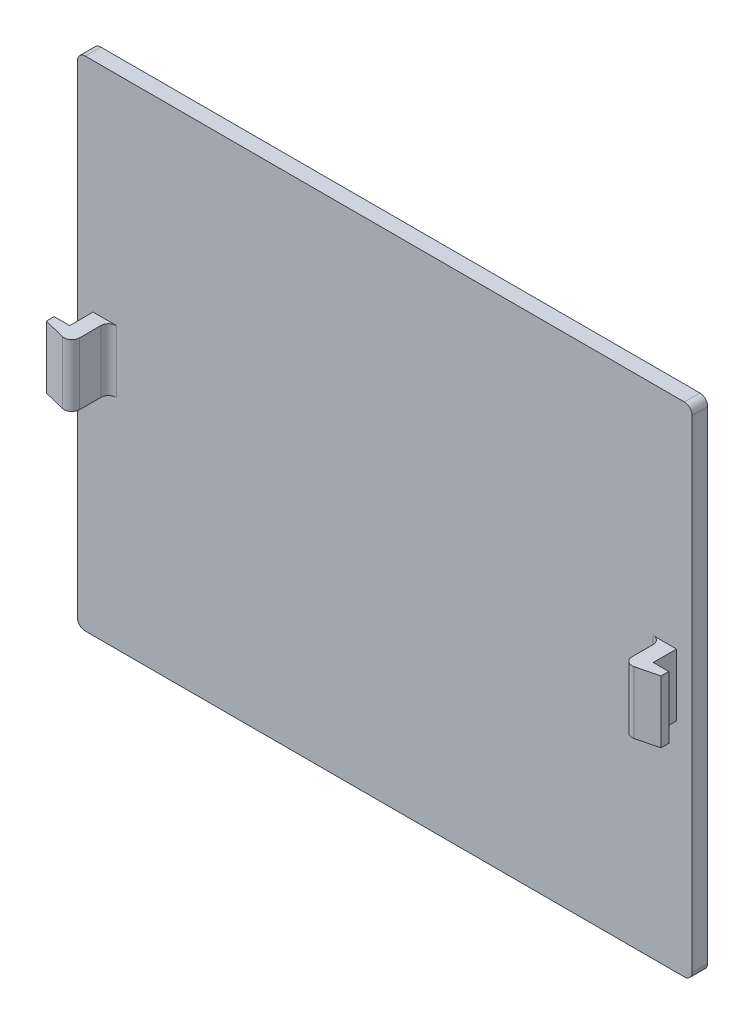
from build123d import *

# Parameters (mm, degrees)
SKETCH_211_W             = 2
SKETCH_211_H             = 8
EXTRUDE_1442_DEPTH       = 2
EXTRUDE_START            = 2
SKETCH_3_W               = 2
SKETCH_3_H               = 8
EXTRUDE_1490_DEPTH       = 3
EXTRUDE_START_2          = 5
SKETCH_4_W               = 2
SKETCH_4_H               = 8
EXTRUDE_1_DEPTH          = 2
CUT_EXTRUDE_2_DEPTH      = 55.219059495
CUT_EXTRUDE_2_DEPTH_BACK = 55.219059495
FILLET_2370_R            = 1
FILLET_4_R               = 1


with BuildPart() as part:
    # Sketch 211 → Extrude 1442 (new body)
    with BuildSketch(Plane.XY):
        Polygon((-38.75749015, -0.345451713), (-38.75749015, -28.345451713), (40.24250985, -28.345451713), (40.24250985, -0.345451713), (38.24250985, -0.345451713), (38.24250985, -26.345451713), (-36.75749015, -26.345451713), (-36.75749015, -0.345451713), align=None)
        with Locations((-37.75749015, 3.654548287)):
            Rectangle(SKETCH_211_W, SKETCH_211_H)
        Polygon((-38.75749015, 35.654548287), (-38.75749015, 7.654548287), (-36.75749015, 7.654548287), (-36.75749015, 33.654548287), (38.24250985, 33.654548287), (38.24250985, 7.654548287), (40.24250985, 7.654548287), (40.24250985, 35.654548287), align=None)
        with Locations((-35.75749015, 3.654548287)):
            Rectangle(SKETCH_211_W, SKETCH_211_H)
        with Locations((37.24250985, 3.654548287)):
            Rectangle(SKETCH_211_W, SKETCH_211_H)
        with Locations((39.24250985, 3.654548287)):
            Rectangle(SKETCH_211_W, SKETCH_211_H)
        Polygon((-34.75749015, -0.345451713), (-36.75749015, -0.345451713), (-36.75749015, -26.345451713), (38.24250985, -26.345451713), (38.24250985, -0.345451713), (36.24250985, -0.345451713), (36.24250985, 7.654548287), (38.24250985, 7.654548287), (38.24250985, 33.654548287), (-36.75749015, 33.654548287), (-36.75749015, 7.654548287), (-34.75749015, 7.654548287), align=None)
    extrude(amount=EXTRUDE_1442_DEPTH)

    # Sketch 3 → Extrude 1490 (add)
    with BuildSketch(Plane.XY.offset(EXTRUDE_START)):
        with Locations((-35.75749015, 3.654548287)):
            Rectangle(SKETCH_3_W, SKETCH_3_H)
        with Locations((37.24250985, 3.654548287)):
            Rectangle(SKETCH_3_W, SKETCH_3_H)
    extrude(amount=EXTRUDE_1490_DEPTH)

    # 基体<4> → 扣子-1 (add)
    with BuildSketch(Plane.XY.offset(EXTRUDE_START_2)):
        with Locations((-37.75749015, 3.654548287)):
            Rectangle(SKETCH_4_W, SKETCH_4_H)
        with Locations((-35.75749015, 3.654548287)):
            Rectangle(SKETCH_4_W, SKETCH_4_H)
        with Locations((37.24250985, 3.654548287)):
            Rectangle(SKETCH_4_W, SKETCH_4_H)
        with Locations((39.24250985, 3.654548287)):
            Rectangle(SKETCH_4_W, SKETCH_4_H)
    extrude(amount=EXTRUDE_1_DEPTH)

    # Sketch 3 2 → 切除-拉伸2 (cut, two sides: drawn at the far end of the back side and taken through both)
    with BuildSketch(Plane(origin=(0, 0, 0), x_dir=(1, 0, 0), z_dir=(0, 1, 0)).offset(-CUT_EXTRUDE_2_DEPTH_BACK)):
        Polygon((-34.75749015, -7), (-38.75749015, -6), (-38.75749015, -7), align=None)
        Polygon((36.24250985, -7), (40.24250985, -6), (40.24250985, -7), align=None)
    extrude(amount=CUT_EXTRUDE_2_DEPTH + CUT_EXTRUDE_2_DEPTH_BACK, mode=Mode.SUBTRACT)

    # Fillet 2370
    fillet_2370_edges = [part.edges().sort_by_distance(p)[0] for p in [
        (40.24250985, -28.345451713, 1),
        (-38.75749015, -28.345451713, 1),
        (-38.75749015, 35.654548287, 1),
        (40.24250985, 35.654548287, 1),
    ]]
    fillet(fillet_2370_edges, radius=FILLET_2370_R)

    # 圆角4
    fillet_4_edges = [part.edges().sort_by_distance(p)[0] for p in [
        (-34.75749015, 3.654548287, 2),
        (36.24250985, 3.654548287, 2),
        (-34.75749015, 3.654548287, 7),
        (36.24250985, 3.654548287, 7),
    ]]
    fillet(fillet_4_edges, radius=FILLET_4_R)


solid = part.part
